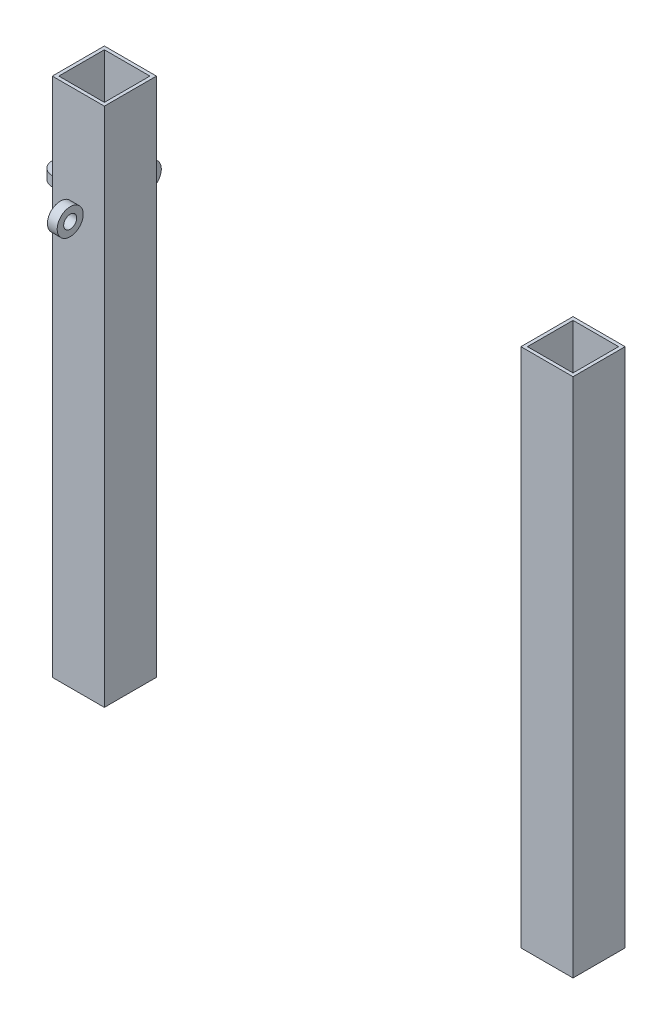
from build123d import *

# Parameters (mm, degrees)
SKETCH2_W             = 25.4
SKETCH2_H             = 25.4
SKETCH2_W_2           = 22.225
SKETCH2_H_2           = 22.225
BOSS_EXTRUDE1_DEPTH   = 254
BOSS_EXTRUDE1_2_DEPTH = 254
BOSS_EXTRUDE2_START   = -15.08125
SKETCH4_R             = 6.35
SKETCH4_R_2           = 3.175
BOSS_EXTRUDE2_DEPTH   = 4.7625
BOSS_EXTRUDE2_2_DEPTH = 4.7625
BOSS_EXTRUDE3_START   = -53.18125
SKETCH5_R             = 6.35
SKETCH5_R_2           = 3.175
BOSS_EXTRUDE3_DEPTH   = 4.7625


with BuildPart() as part:
    # Sketch2 → Boss-Extrude1 (new body)
    with BuildSketch(Plane(origin=(0, 0, 0), x_dir=(1, 0, 0), z_dir=(0, 1, 0))):
        with Locations((12.7, 12.7)):
            Rectangle(SKETCH2_W, SKETCH2_H)
        with Locations((12.7, 12.7)):
            Rectangle(SKETCH2_W_2, SKETCH2_H_2, mode=Mode.SUBTRACT)
    extrude(amount=BOSS_EXTRUDE1_DEPTH)


with BuildPart() as body_2:
    # Sketch2 → Boss-Extrude1 2 (new body)
    with BuildSketch(Plane(origin=(0, 0, 0), x_dir=(1, 0, 0), z_dir=(0, 1, 0))):
        with Locations((241.3, 12.7)):
            Rectangle(SKETCH2_W, SKETCH2_H)
        with Locations((241.3, 12.7)):
            Rectangle(SKETCH2_W_2, SKETCH2_H_2, mode=Mode.SUBTRACT)
    extrude(amount=BOSS_EXTRUDE1_2_DEPTH)


with BuildPart() as body_3:
    # Sketch4 → Boss-Extrude2 (new body)
    with BuildSketch(Plane.ZY.offset(BOSS_EXTRUDE2_START)):
        with Locations(Location((-31.75, 203.2, 0), (0, 0, 180))):
            Circle(SKETCH4_R)
        with Locations(Location((-31.75, 203.2, 0), (0, 0, 180))):
            Circle(SKETCH4_R_2, mode=Mode.SUBTRACT)
    extrude(amount=BOSS_EXTRUDE2_DEPTH)


with BuildPart() as body_4:
    # Sketch4 → Boss-Extrude2 2 (new body)
    with BuildSketch(Plane.ZY.offset(BOSS_EXTRUDE2_START)):
        with Locations(Location((6.35, 203.2, 0), (0, 0, 180))):
            Circle(SKETCH4_R)
        with Locations(Location((6.35, 203.2, 0), (0, 0, 180))):
            Circle(SKETCH4_R_2, mode=Mode.SUBTRACT)
    extrude(amount=BOSS_EXTRUDE2_2_DEPTH)


with BuildPart() as body_5:
    # Sketch5 → Boss-Extrude3 (new body)
    with BuildSketch(Plane(origin=(0, 254, 0), x_dir=(1, 0, 0), z_dir=(0, 1, 0)).offset(BOSS_EXTRUDE3_START)):
        with Locations(Location((-6.35, 12.7, 0), (0, 0, 90))):
            Circle(SKETCH5_R)
        with Locations(Location((-6.35, 12.7, 0), (0, 0, 90))):
            Circle(SKETCH5_R_2, mode=Mode.SUBTRACT)
    extrude(amount=BOSS_EXTRUDE3_DEPTH)


solid = Compound([part.part, body_2.part, body_3.part, body_4.part, body_5.part])
